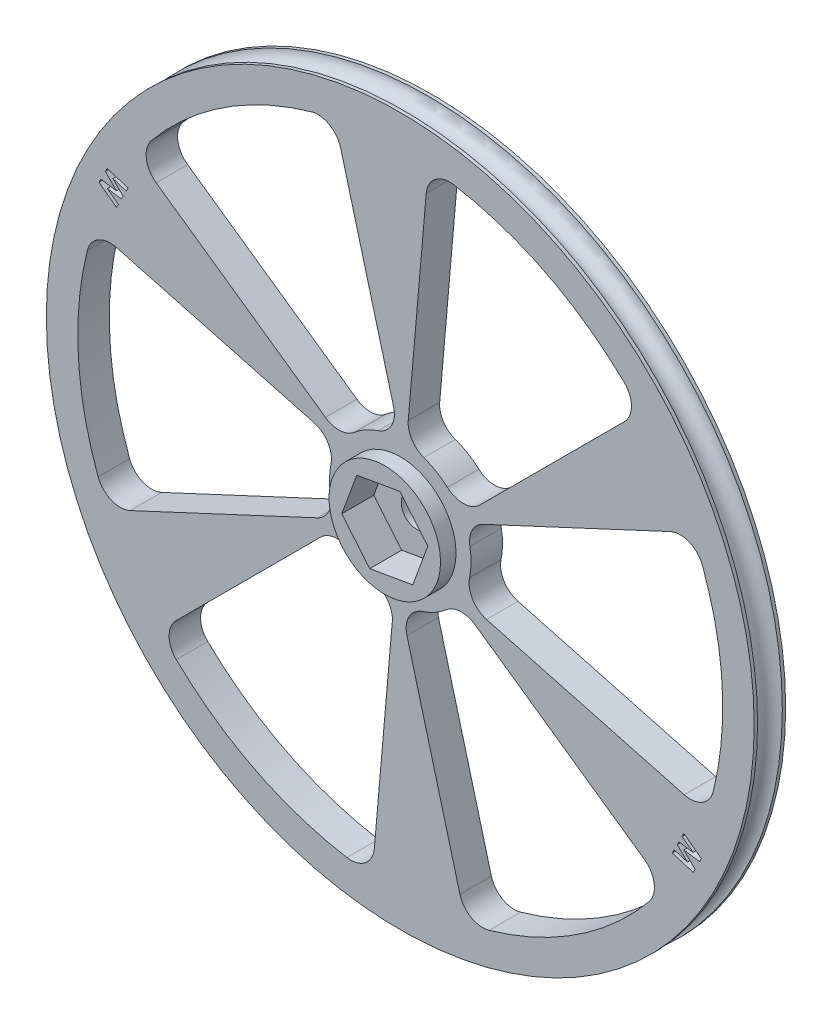
from build123d import *

# Parameters (mm, degrees)
SKETCH1_R                = 57.15
BOSS_EXTRUDE3_DEPTH      = 2.54
CUT_EXTRUDE1_DEPTH       = 81.98179672
FILLET1_R                = 3.81
CIRPATTERN1_COUNT        = 6
FILLET1_OF_CIRPATTERN1_R = 3.81
CUT_EXTRUDE2_DEPTH       = 81.98179672
CUT_EXTRUDE2_DEPTH_BACK  = 81.98179672
SKETCH4_R                = 2.5
CUT_EXTRUDE3_DEPTH       = 2.667
SKETCH5_3_R              = 9
BOSS_EXTRUDE9_DEPTH      = 2.5
SKETCH11_R               = 2
CUT_EXTRUDE4_DEPTH       = 81.98179672


with BuildPart() as part:
    # Sketch1 → Boss-Extrude3 (new, symmetric)
    with BuildSketch(Plane.XY):
        Circle(SKETCH1_R)
    extrude(amount=BOSS_EXTRUDE3_DEPTH, both=True)

    # Sketch3 → Cut-Extrude1 (cut, symmetric)
    with BuildSketch(Plane.XY.offset(2.54)):
        with BuildLine():
            ThreePointArc((-10.597439882, 50.980184071), (-28.641923541, 43.48476878), (-42.653246946, 29.866125041))
            Line((-42.653246946, 29.866125041), (-9.362907866, 6.555978667))
            ThreePointArc((-9.362907866, 6.555978667), (-5.277786649, 10.138533823), (0, 11.43))
            Line((0, 11.43), (-10.597439882, 50.980184071))
        make_face()
    cut_extrude1 = extrude(amount=CUT_EXTRUDE1_DEPTH, both=True, mode=Mode.SUBTRACT)

    # Fillet1
    fillet1_edges = [part.edges().sort_by_distance(p)[0] for p in [
        (-9.362907866, 6.555978667, 0),
        (-42.653246946, 29.866125041, 0),
        (0, 11.43, 0),
        (-10.597439882, 50.980184071, 0),
    ]]
    fillet(fillet1_edges, radius=FILLET1_R)

    # CirPattern1: Cut-Extrude1 ×6 about axis
    cirpattern1_axis = Axis((0, 0, 2.54), (0, 0, -1))
    for i in range(1, CIRPATTERN1_COUNT):
        add(cut_extrude1.rotate(cirpattern1_axis, i * 360 / CIRPATTERN1_COUNT), mode=Mode.SUBTRACT)

    # Fillet1 of CirPattern1
    fillet1_of_cirpattern1_edges = [part.edges().sort_by_distance(p)[0] for p in [
        (0.99619014, 11.386505399, 0),
        (4.538199525, 51.87185793, 0),
        (9.898670365, 5.715, 0),
        (38.851414554, 34.667744189, 0),
        (10.359098006, 4.830526732, 0),
        (47.191446471, 22.005732889, 0),
        (9.898670365, -5.715, 0),
        (49.448854437, -16.312439882, 0),
        (9.362907866, -6.555978667, 0),
        (42.653246946, -29.866125041, 0),
        (0, -11.43, 0),
        (10.597439882, -50.980184071, 0),
        (-0.99619014, -11.386505399, 0),
        (-4.538199525, -51.87185793, 0),
        (-9.898670365, -5.715, 0),
        (-38.851414554, -34.667744189, 0),
        (-10.359098006, -4.830526732, 0),
        (-47.191446471, -22.005732889, 0),
        (-9.898670365, 5.715, 0),
        (-49.448854437, 16.312439882, 0),
    ]]
    fillet(fillet1_of_cirpattern1_edges, radius=FILLET1_OF_CIRPATTERN1_R)

    # Sketch4 → Cut-Extrude2 (cut, two sides: drawn at the far end of the back side and taken through both)
    with BuildSketch(Plane.XY.offset(2.54).offset(-CUT_EXTRUDE2_DEPTH_BACK)):
        Circle(SKETCH4_R)
    extrude(amount=CUT_EXTRUDE2_DEPTH + CUT_EXTRUDE2_DEPTH_BACK, mode=Mode.SUBTRACT)

    # Sketch5 → Cut-Extrude3 (cut, symmetric)
    with BuildSketch(Plane.XY.offset(2.54)):
        Polygon((4.515050808, -5.41450055), (6.946620429, 1.202898424), (2.431569621, 6.617398974), (-4.515050808, 5.41450055), (-6.946620429, -1.202898424), (-2.431569621, -6.617398974), align=None)
    extrude(amount=CUT_EXTRUDE3_DEPTH, both=True, mode=Mode.SUBTRACT)

    # Sketch5<3> → Boss-Extrude9 (add)
    with BuildSketch(Plane.XY.offset(2.54)):
        Circle(SKETCH5_3_R)
        Polygon((4.515050808, -5.41450055), (6.946620429, 1.202898424), (2.431569621, 6.617398974), (-4.515050808, 5.41450055), (-6.946620429, -1.202898424), (-2.431569621, -6.617398974), align=None, mode=Mode.SUBTRACT)
    extrude(amount=BOSS_EXTRUDE9_DEPTH)

    # Sketch11 → Cut-Revolve1 (revolve, cut)
    with BuildSketch(Plane(origin=(0, 0, 0), x_dir=(0, 0, -1), z_dir=(1, 0, 0))):
        with Locations((0, 57.15)):
            Circle(SKETCH11_R)
    revolve(axis=Axis((0, 0, 5.04), (0, 0, -1)), mode=Mode.SUBTRACT)

    # Sketch12 → Cut-Extrude4 (cut, through all)
    with BuildSketch(Plane.XY.offset(2.54)):
        Polygon((-48.637599982, 23.067154966), (-48.34382995, 23.643477082), (-45.821193732, 23.258561216), (-47.609054309, 25.08428237), (-47.319491007, 25.652191024), (-43.959715366, 24.596301601), (-44.249278668, 24.028392947), (-46.372976584, 24.692355287), (-44.75408636, 23.037707851), (-45.019110398, 22.518176601), (-47.30476745, 22.864530768), (-45.523216969, 21.52959487), (-45.815584757, 20.95537612), align=None)
        Polygon((47.301176757, -25.475850915), (47.59425656, -24.899177488), (45.798508906, -23.086129205), (48.326749768, -23.45721049), (48.615502847, -22.888889451), (45.784622613, -20.793868703), (45.495869534, -21.362189742), (47.282457589, -22.688478531), (44.991967867, -22.353335985), (44.727887152, -22.873347367), (46.352998071, -24.517489655), (44.225273466, -23.862688943), (43.933069043, -24.436990843), align=None)
    extrude(amount=-CUT_EXTRUDE4_DEPTH, mode=Mode.SUBTRACT)


solid = part.part
